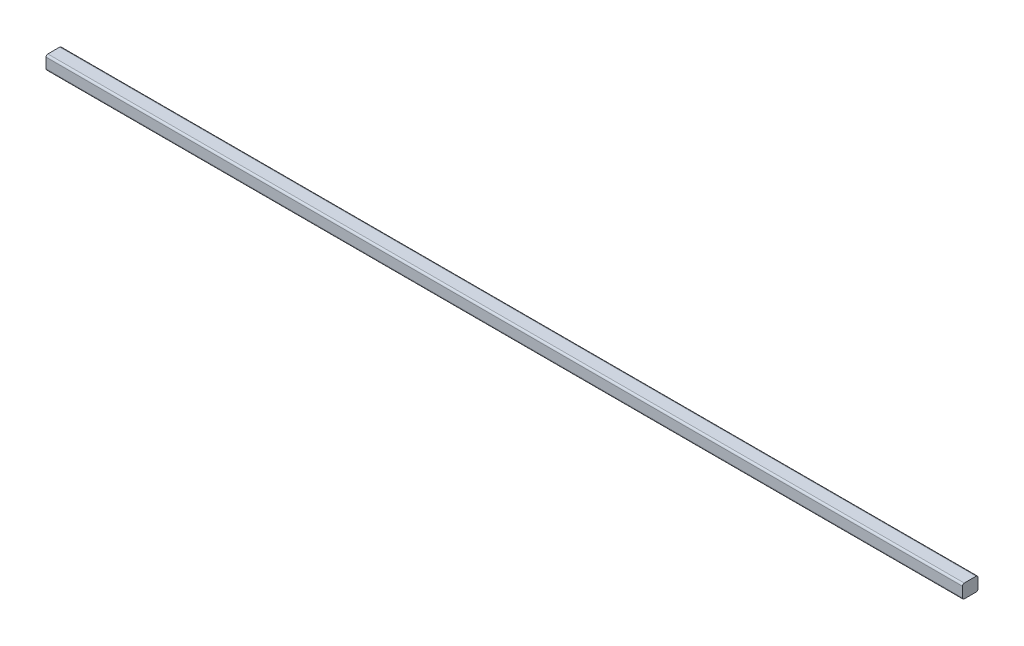
from build123d import *

# Parameters (mm, degrees)
SKETCH3_W           = 8.5
SKETCH3_H           = 7.5
BOSS_EXTRUDE1_DEPTH = 500
FILLET2_R           = 1


with BuildPart() as part:
    # Sketch3 → Boss-Extrude1 (new body)
    with BuildSketch(Plane(origin=(0, 0, 0), x_dir=(0, 0, -1), z_dir=(1, 0, 0))):
        Rectangle(SKETCH3_W, SKETCH3_H)
    extrude(amount=BOSS_EXTRUDE1_DEPTH)

    # Fillet2
    fillet2_edges = [part.edges().sort_by_distance(p)[0] for p in [
        (250, 3.75, 4.25),
        (250, 3.75, -4.25),
        (250, -3.75, -4.25),
        (250, -3.75, 4.25),
    ]]
    fillet(fillet2_edges, radius=FILLET2_R)


solid = part.part
